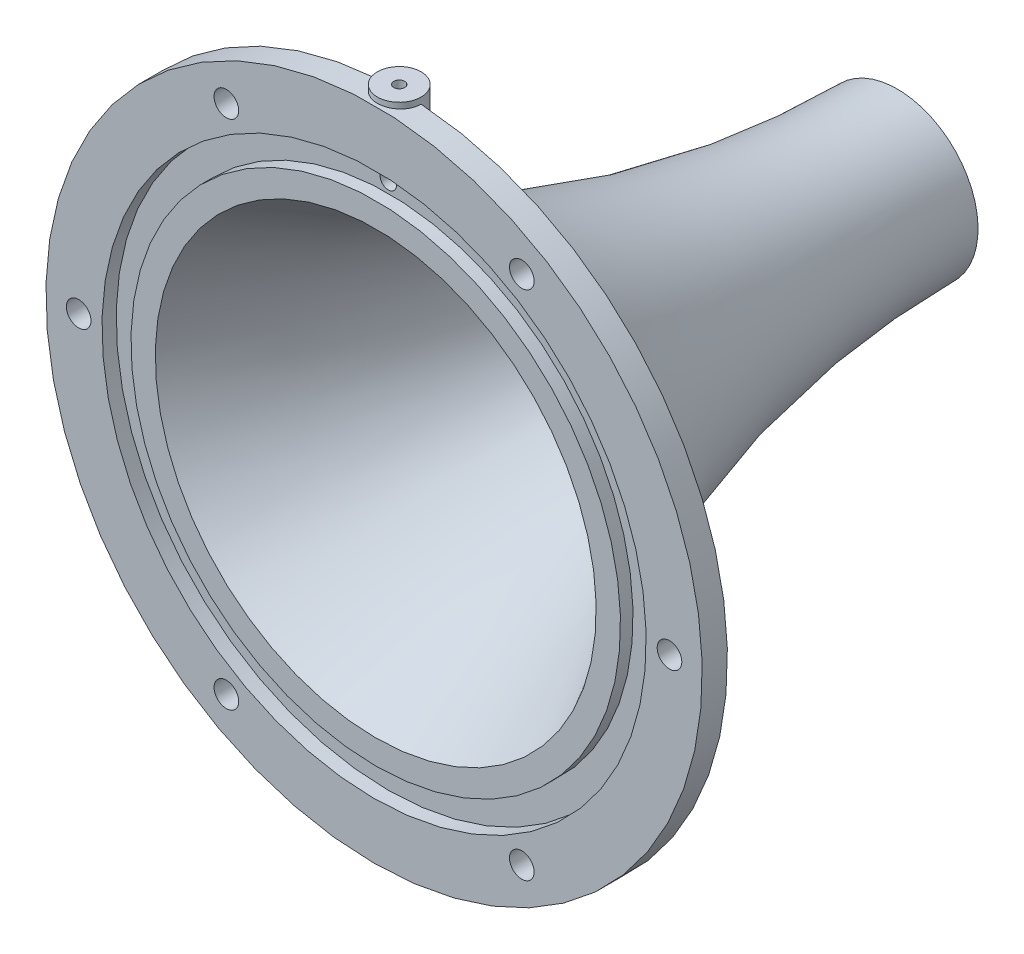
from build123d import *

# Parameters (mm, degrees)
BOSS_EXTRUDE1_REACH     = 167.297
SKETCH3_R               = 4
SKETCH4_R               = 1
CUT_EXTRUDE1_DEPTH      = 14
SKETCH5_R               = 1.5
CUT_EXTRUDE2_DEPTH      = 5.2
CUT_EXTRUDE3_DEPTH      = 129.074548772
CUT_EXTRUDE3_DEPTH_BACK = 129.074548772
SKETCH6_R               = 2.25


with BuildPart() as part:
    # Sketch2 → Revolve1 (revolve)
    with BuildSketch(Plane(origin=(0, 0, 0), x_dir=(0, 0, -1), z_dir=(1, 0, 0)), mode=Mode.PRIVATE) as revolve1_sk:
        with BuildLine():
            Line((95.3, 14.75), (95.3, 12.75))
            ThreePointArc((95.3, 12.75), (45.630862999, 19.624348561), (-0.05, 40.301354974))
            Line((-0.05, 40.301354974), (-0.05, 44.75))
            Line((-0.05, 44.75), (2.25, 44.75))
            Line((2.25, 44.75), (2.25, 49.75))
            Line((2.25, 49.75), (-0.35, 49.75))
            Line((-0.35, 49.75), (-0.35, 60))
            Line((-0.35, 60), (4.25, 60))
            Line((4.25, 60), (4.25, 40.301354974))
            ThreePointArc((4.25, 40.301354974), (48.016349969, 21.258883202), (95.3, 14.75))
        make_face()
    revolve(revolve1_sk.sketch.rotate(Axis((0, 0, 95.3), (0, 0, -1)), 180), axis=Axis((0, 0, 95.3), (0, 0, -1)))

    # Sketch3 → Boss-Extrude1 (add, up to next)
    with BuildSketch(Plane(origin=(0, 61, 0), x_dir=(-1, 0, 0), z_dir=(0, -1, 0)), mode=Mode.PRIVATE) as boss_extrude1_sk1:
        with Locations(Location((0, 4.25, 0), (0, 0, 180))):
            Circle(SKETCH3_R)
    boss_extrude1_tool1 = extrude(boss_extrude1_sk1.sketch, amount=BOSS_EXTRUDE1_REACH, mode=Mode.PRIVATE) - part.part
    add(boss_extrude1_tool1.solids().sort_by_distance((0, 61, -4.25))[0])

    # Sketch4 → Cut-Extrude1 (cut)
    with BuildSketch(Plane(origin=(0, 61, 0), x_dir=(1, 0, 0), z_dir=(0, 1, 0))):
        with Locations(Location((0, 4.25, 0), (0, 0, 180))):
            Circle(SKETCH4_R)
    extrude(amount=-CUT_EXTRUDE1_DEPTH, mode=Mode.SUBTRACT)

    # Sketch5 → Cut-Extrude2 (cut)
    with BuildSketch(Plane.XY):
        with Locations(Location((0, 46.797368966, 0), (0, 0, 77.98506808))):
            Circle(SKETCH5_R)
    extrude(amount=-CUT_EXTRUDE2_DEPTH, mode=Mode.SUBTRACT)

    # Sketch6 → Cut-Extrude3 (cut, two sides: drawn at the far end of the back side and taken through both)
    with BuildSketch(Plane.XY.offset(-CUT_EXTRUDE3_DEPTH_BACK)):
        with Locations((54, 0)):
            Circle(SKETCH6_R)
        with Locations((27, -46.765371804)):
            Circle(SKETCH6_R)
        with Locations((-27, -46.765371804)):
            Circle(SKETCH6_R)
        with Locations((-54, 0)):
            Circle(SKETCH6_R)
        with Locations((-27, 46.765371804)):
            Circle(SKETCH6_R)
        with Locations((27, 46.765371804)):
            Circle(SKETCH6_R)
    extrude(amount=CUT_EXTRUDE3_DEPTH + CUT_EXTRUDE3_DEPTH_BACK, mode=Mode.SUBTRACT)


solid = part.part
